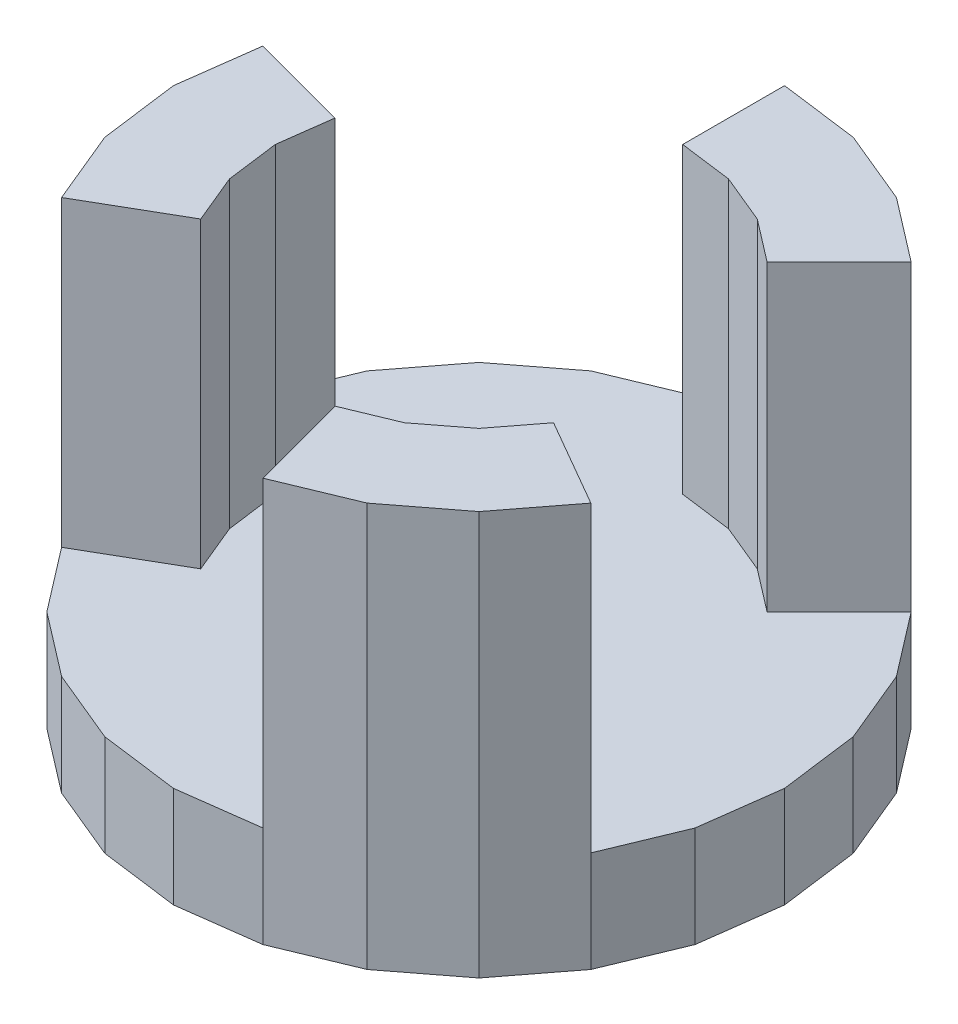
from build123d import *

# Parameters (mm, degrees)
BOSS_EXTRUDE3_DEPTH   = 40
BOSS_EXTRUDE3_2_DEPTH = 40
BOSS_EXTRUDE3_3_DEPTH = 40
BOSS_EXTRUDE4_DEPTH   = 10


with BuildPart() as part:
    # Sketch1 → Boss-Extrude3 (new body)
    with BuildSketch(Plane(origin=(0, 0, 0), x_dir=(1, 0, 0), z_dir=(0, 1, 0))):
        Polygon((0, 30.258868817), (0, 20.172579212), (5.221047689, 19.485215243), (10.086289606, 17.469966057), (14.264167555, 14.264167555), (21.396251332, 21.396251332), (15.129434409, 26.204949086), (7.831571533, 29.227822865), align=None)
    extrude(amount=BOSS_EXTRUDE3_DEPTH)



with BuildPart() as body_2:
    # Sketch1 → Boss-Extrude3 2 (new body)
    with BuildSketch(Plane(origin=(0, 0, 0), x_dir=(1, 0, 0), z_dir=(0, 1, 0))):
        Polygon((-20.172579212, 0), (-19.485215243, 5.221047689), (-29.227822865, 7.831571533), (-30.258868817, 0), (-29.227822865, -7.831571533), (-26.204949086, -15.129434409), (-17.469966057, -10.086289606), (-19.485215243, -5.221047689), align=None)
    extrude(amount=BOSS_EXTRUDE3_2_DEPTH)


with BuildPart() as body_3:
    # Sketch1 → Boss-Extrude3 3 (new body)
    with BuildSketch(Plane(origin=(0, 0, 0), x_dir=(1, 0, 0), z_dir=(0, 1, 0))):
        Polygon((26.204949086, -15.129434409), (17.469966057, -10.086289606), (14.264167555, -14.264167555), (10.086289606, -17.469966057), (5.221047689, -19.485215243), (7.831571533, -29.227822865), (15.129434409, -26.204949086), (21.396251332, -21.396251332), align=None)
    extrude(amount=BOSS_EXTRUDE3_3_DEPTH)


with BuildPart() as part_1:
    add(part.part)

    add(body_2.part)  # Boss-Extrude4 merges body 2

    add(body_3.part)  # Boss-Extrude4 merges body 3
    # Sketch1<6> → Boss-Extrude4 (add)
    with BuildSketch(Plane(origin=(0, 0, 0), x_dir=(1, 0, 0), z_dir=(0, 1, 0))):
        Polygon((-29.227822865, 7.831571533), (-19.485215243, 5.221047689), (-20.172579212, 0), (-19.485215243, -5.221047689), (-17.469966057, -10.086289606), (-26.204949086, -15.129434409), (-21.396251332, -21.396251332), (-15.129434409, -26.204949086), (-7.831571533, -29.227822865), (0, -30.258868817), (7.831571533, -29.227822865), (5.221047689, -19.485215243), (10.086289606, -17.469966057), (14.264167555, -14.264167555), (17.469966057, -10.086289606), (26.204949086, -15.129434409), (29.227822865, -7.831571533), (30.258868817, 0), (29.227822865, 7.831571533), (26.204949086, 15.129434409), (21.396251332, 21.396251332), (14.264167555, 14.264167555), (10.086289606, 17.469966057), (5.221047689, 19.485215243), (0, 20.172579212), (0, 30.258868817), (-7.831571533, 29.227822865), (-15.129434409, 26.204949086), (-21.396251332, 21.396251332), (-26.204949086, 15.129434409), align=None)
        with BuildLine():
            ThreePointArc((1.5, 1.322875656), (0, -2), (-1.5, 1.322875656))
            Line((-1.5, 1.322875656), (1.5, 1.322875656))
        make_face(mode=Mode.SUBTRACT)
    extrude(amount=BOSS_EXTRUDE4_DEPTH)


solid = part_1.part
